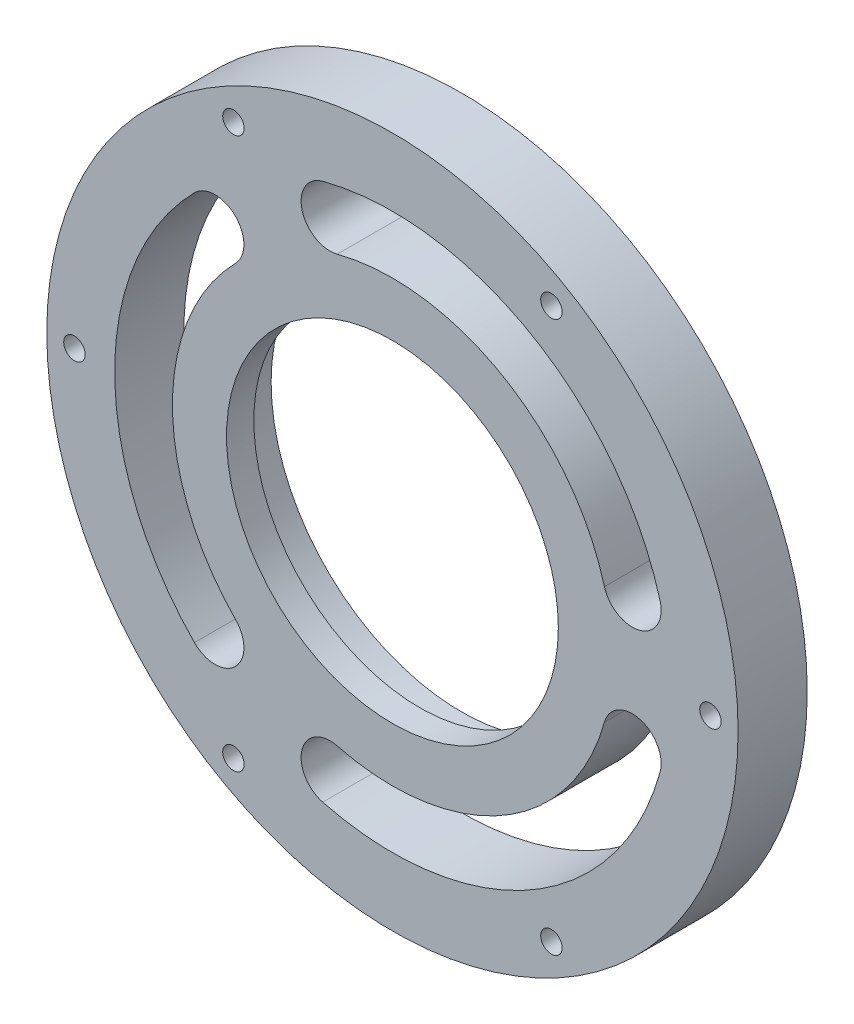
from build123d import *

# Parameters (mm, degrees)
SKETCH_1_R          = 50
SKETCH_1_R_2        = 42
SKETCH_1_R_3        = 1.55
EXTRUDE_1_DEPTH     = 10
EXTRUDE_START       = -10
SKETCH_3_R          = 42
SKETCH_3_R_2        = 27.55
EXTRUDE_2_DEPTH     = 10
SKETCH_5_R          = 28.648994564
SKETCH_5_R_2        = 24
EXTRUDE_4_DEPTH     = 3.95
CUT_EXTRUDE_1_DEPTH = 10


with BuildPart() as part:
    # 草图1 → 凸台-拉伸1 (new body)
    with BuildSketch(Plane.XY):
        Circle(SKETCH_1_R)
        Circle(SKETCH_1_R_2, mode=Mode.SUBTRACT)
        with Locations((46, 0)):
            Circle(SKETCH_1_R_3, mode=Mode.SUBTRACT)
        with Locations((23, -39.837168574)):
            Circle(SKETCH_1_R_3, mode=Mode.SUBTRACT)
        with Locations((-23, -39.837168574)):
            Circle(SKETCH_1_R_3, mode=Mode.SUBTRACT)
        with Locations((-46, 0)):
            Circle(SKETCH_1_R_3, mode=Mode.SUBTRACT)
        with Locations((-23, 39.837168574)):
            Circle(SKETCH_1_R_3, mode=Mode.SUBTRACT)
        with Locations((23, 39.837168574)):
            Circle(SKETCH_1_R_3, mode=Mode.SUBTRACT)
    extrude(amount=EXTRUDE_1_DEPTH)

    # 草图3 → 凸台-拉伸2 (add)
    with BuildSketch(Plane.XY.offset(10).offset(EXTRUDE_START)):
        Circle(SKETCH_3_R)
        Circle(SKETCH_3_R_2, mode=Mode.SUBTRACT)
    extrude(amount=EXTRUDE_2_DEPTH)

    # 草图5 → 凸台-拉伸4 (add)
    with BuildSketch(Plane.XY.offset(10)):
        Circle(SKETCH_5_R)
        Circle(SKETCH_5_R_2, mode=Mode.SUBTRACT)
    extrude(amount=-EXTRUDE_4_DEPTH)

    # 草图6 → 切除-拉伸1 (cut)
    with BuildSketch(Plane(origin=(0, 0, 0), x_dir=(-1, 0, 0), z_dir=(0, 0, -1))):
        with BuildLine():
            ThreePointArc((10.083378512, 38.891869692), (-20.088877833, 34.794957074), (-38.72303641, 10.713472899))
            ThreePointArc((-38.72303641, 10.713472899), (-35.810551361, 5.572975291), (-30.670053754, 8.48546034))
            ThreePointArc((-30.670053754, 8.48546034), (-15.911122167, 27.558871999), (7.98640266, 30.803775856))
            ThreePointArc((7.98640266, 30.803775856), (13.078937504, 33.799334848), (10.083378512, 38.891869692))
        make_face()
        with BuildLine():
            ThreePointArc((28.639657898, -28.178396793), (40.177755666, 0), (28.639657898, 28.178396793))
            ThreePointArc((28.639657898, 28.178396793), (22.731613858, 28.226359557), (22.683651094, 22.318315516))
            ThreePointArc((22.683651094, 22.318315516), (31.822244334, 0), (22.683651094, -22.318315516))
            ThreePointArc((22.683651094, -22.318315516), (22.731613858, -28.226359557), (28.639657898, -28.178396793))
        make_face()
        with BuildLine():
            ThreePointArc((-38.72303641, -10.713472899), (-20.088877833, -34.794957074), (10.083378512, -38.891869692))
            ThreePointArc((10.083378512, -38.891869692), (13.078937504, -33.799334848), (7.98640266, -30.803775856))
            ThreePointArc((7.98640266, -30.803775856), (-15.911122167, -27.558871999), (-30.670053754, -8.48546034))
            ThreePointArc((-30.670053754, -8.48546034), (-35.810551361, -5.572975291), (-38.72303641, -10.713472899))
        make_face()
    extrude(amount=-CUT_EXTRUDE_1_DEPTH, mode=Mode.SUBTRACT)


solid = part.part
